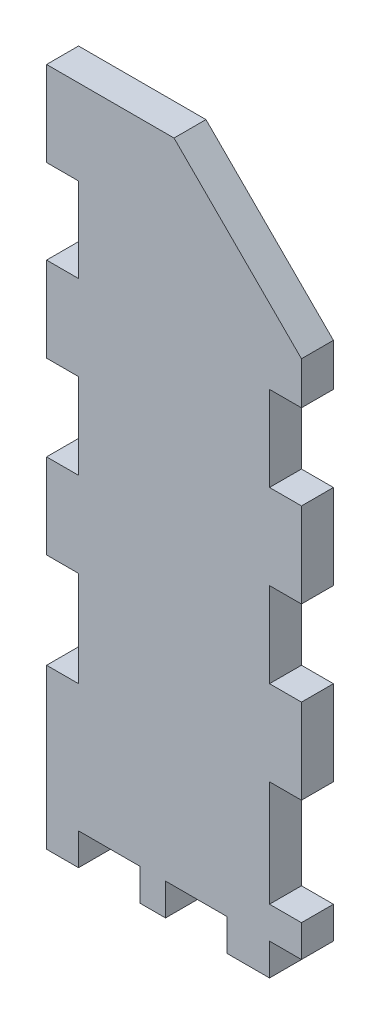
from build123d import *

# Parameters (mm, degrees)
BOSS_EXTRUDE1_DEPTH = 4.7752
SKETCH3_W           = 9.1948
SKETCH3_H           = 4.7752
SKETCH3_W_2         = 4.7752
CUT_EXTRUDE4_DEPTH  = 6.35
SKETCH4_W           = 4.7752
SKETCH4_H           = 12.774972335
SKETCH4_H_2         = 12.7
SKETCH4_H_3         = 14.2748
SKETCH4_H_4         = 15.8496
SKETCH4_H_5         = 12.625027665
CUT_EXTRUDE5_DEPTH  = 6.35


with BuildPart() as part:
    # Sketch2 → Boss-Extrude1 (new body)
    with BuildSketch(Plane.XY):
        Polygon((0, 0), (0, 101.6), (19.05, 101.6), (38.1, 82.55), (38.1, 0), align=None)
    extrude(amount=BOSS_EXTRUDE1_DEPTH)

    # Sketch3 → Cut-Extrude4 (cut)
    with BuildSketch(Plane.XY.offset(4.7752)):
        with Locations((9.3726, 2.3876)):
            Rectangle(SKETCH3_W, SKETCH3_H)
        with Locations((22.3774, 2.3876)):
            Rectangle(SKETCH3_W, SKETCH3_H)
        with Locations((35.7124, 2.3876)):
            Rectangle(SKETCH3_W_2, SKETCH3_H)
    extrude(amount=-CUT_EXTRUDE4_DEPTH, mode=Mode.SUBTRACT)

    # Sketch4 → Cut-Extrude5 (cut)
    with BuildSketch(Plane.XY.offset(4.7752)):
        with Locations((2.3876, 57.187486168)):
            Rectangle(SKETCH4_W, SKETCH4_H)
        with Locations((35.7124, 44.45)):
            Rectangle(SKETCH4_W, SKETCH4_H_2)
        with Locations((2.3876, 30.9626)):
            Rectangle(SKETCH4_W, SKETCH4_H_3)
        with Locations((35.7124, 17.4752)):
            Rectangle(SKETCH4_W, SKETCH4_H_4)
        with Locations((35.7124, 69.85)):
            Rectangle(SKETCH4_W, SKETCH4_H_2)
        with Locations((2.3876, 82.587486168)):
            Rectangle(SKETCH4_W, SKETCH4_H_5)
    extrude(amount=-CUT_EXTRUDE5_DEPTH, mode=Mode.SUBTRACT)


solid = part.part
